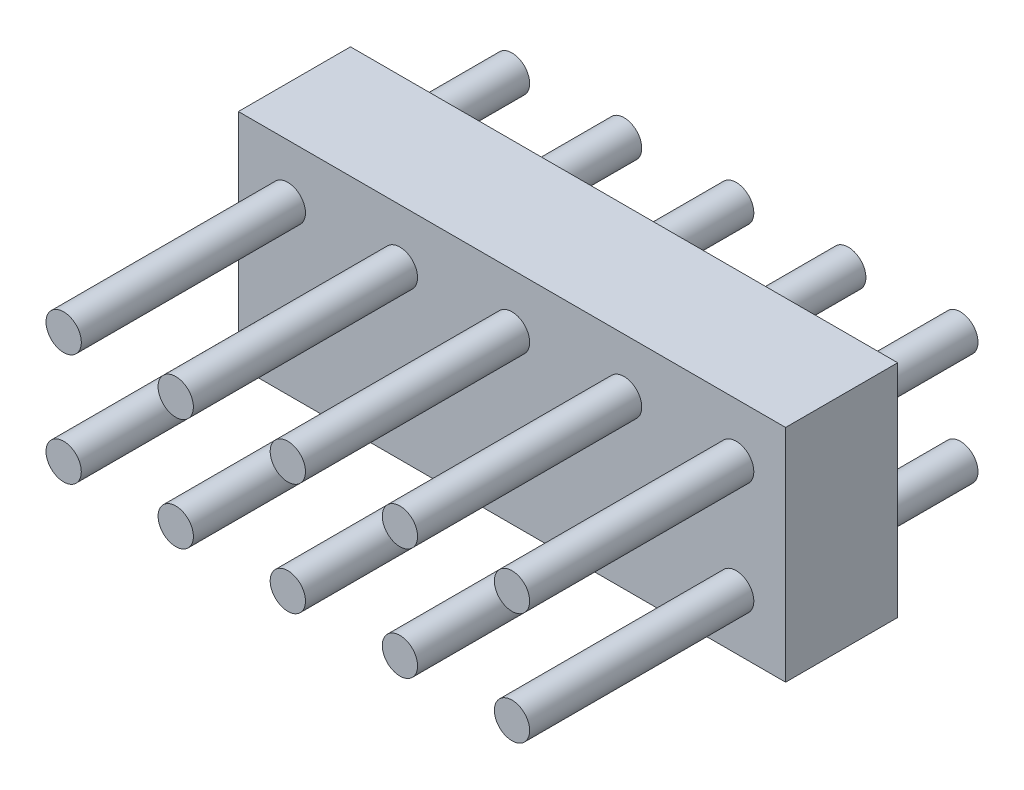
from build123d import *

# Parameters (mm, degrees)
SKETCH_1_W      = 12.4
SKETCH_1_H      = 5
EXTRUDE_1_DEPTH = 2.54
SKETCH_2_R      = 0.4
EXTRUDE_2_DEPTH = 5.08


with BuildPart() as part:
    # 草图1 → 凸台-拉伸1 (new body)
    with BuildSketch(Plane.XY):
        with Locations((6.2, -2.5)):
            Rectangle(SKETCH_1_W, SKETCH_1_H)
    extrude(amount=EXTRUDE_1_DEPTH)

    # 草图2 → 凸台-拉伸2 (add, symmetric)
    with BuildSketch(Plane.XY.offset(2.54)):
        with Locations((6.2, -1.23)):
            Circle(SKETCH_2_R)
        with Locations((8.74, -1.23)):
            Circle(SKETCH_2_R)
        with Locations((11.28, -1.23)):
            Circle(SKETCH_2_R)
        with Locations(Location((1.12, -1.23, 0), (0, 0, 180))):
            Circle(SKETCH_2_R)
        with Locations(Location((3.66, -1.23, 0), (0, 0, 180))):
            Circle(SKETCH_2_R)
        with Locations(Location((11.28, -3.77, 0), (0, 0, 180))):
            Circle(SKETCH_2_R)
        with Locations(Location((8.74, -3.77, 0), (0, 0, 180))):
            Circle(SKETCH_2_R)
        with Locations(Location((6.2, -3.77, 0), (0, 0, 180))):
            Circle(SKETCH_2_R)
        with Locations((3.66, -3.77)):
            Circle(SKETCH_2_R)
        with Locations((1.12, -3.77)):
            Circle(SKETCH_2_R)
    extrude(amount=EXTRUDE_2_DEPTH, both=True)


solid = part.part
